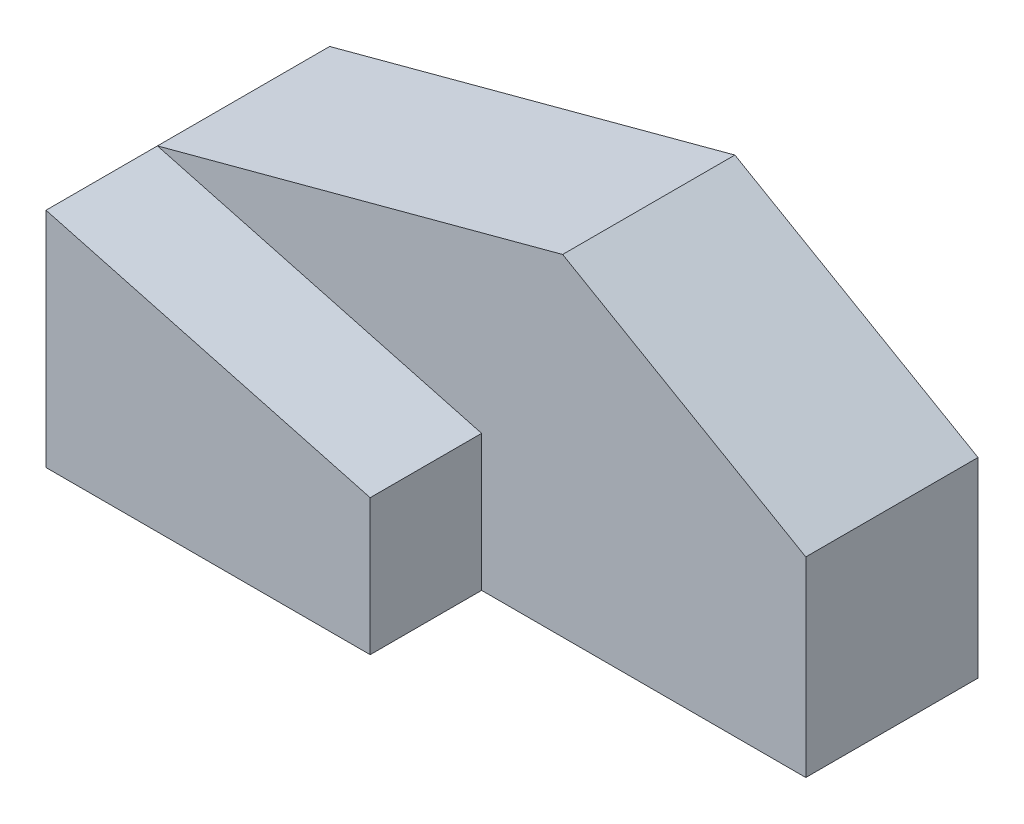
from build123d import *

# Parameters (mm, degrees)
EXTRUDE_1_DEPTH = 17
EXTRUDE_2_DEPTH = 11


with BuildPart() as part:
    # 草圖1 → 伸長1 (new body)
    with BuildSketch(Plane.XY):
        Polygon((0, 0), (0, 22), (40, 32.717967697), (64, 18.861561237), (64, 0), align=None)
    extrude(amount=EXTRUDE_1_DEPTH)

    # 草圖2 → 伸長2 (add)
    with BuildSketch(Plane.XY.offset(17)):
        Polygon((0, 0), (32, 0), (32, 13.425625842), (0, 22), align=None)
    extrude(amount=EXTRUDE_2_DEPTH)


solid = part.part
